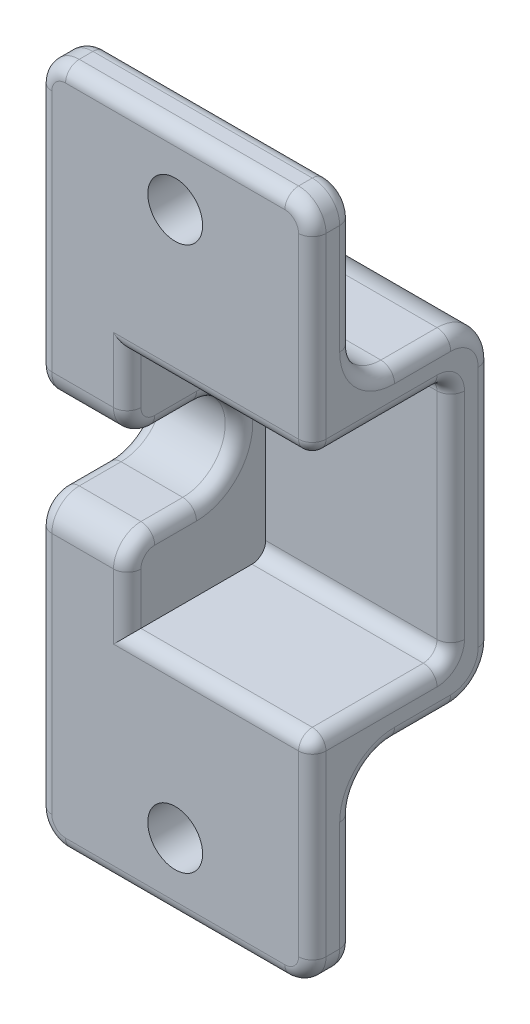
from build123d import *

# Parameters (mm, degrees)
BOSS_EXTRUDE1_DEPTH = 13.5
BOSS_EXTRUDE2_DEPTH = 6.5
FILLET1_R           = 3
FILLET2_R           = 2
SKETCH3_R           = 2
CUT_EXTRUDE1_DEPTH  = 3
FILLET3_R           = 1


with BuildPart() as part:
    # Sketch1 → Boss-Extrude1 (new body)
    with BuildSketch(Plane(origin=(0, 0, 0), x_dir=(0, 0, -1), z_dir=(1, 0, 0))):
        Polygon((0, 0), (3, 0), (3, 13), (13.1, 13), (13.1, 36.7), (3, 36.7), (3, 49.7), (0, 49.7), (0, 33.7), (10.1, 33.7), (10.1, 16), (0, 16), align=None)
    extrude(amount=BOSS_EXTRUDE1_DEPTH)

    # Sketch2 → Boss-Extrude2 (add)
    with BuildSketch(Plane.ZY):
        with BuildLine():
            Line((0, 0), (-3, 0))
            Line((-3, 0), (-3, 13))
            Line((-3, 13), (-13.1, 13))
            Line((-13.1, 13), (-13.1, 36.7))
            Line((-13.1, 36.7), (-3, 36.7))
            Line((-3, 36.7), (-3, 49.7))
            Line((-3, 49.7), (0, 49.7))
            Line((0, 49.7), (0, 27.95))
            Line((0, 27.95), (-5.05, 27.95))
            ThreePointArc((-5.05, 27.95), (-8.15, 24.85), (-5.05, 21.75))
            Line((-5.05, 21.75), (0, 21.75))
            Line((0, 21.75), (0, 0))
        make_face()
    extrude(amount=BOSS_EXTRUDE2_DEPTH)

    # Fillet1
    fillet1_edges = [part.edges().sort_by_distance(p)[0] for p in [
        (3.5, 36.7, -3),
        (3.5, 36.7, -13.1),
        (3.5, 13, -13.1),
        (3.5, 13, -3),
    ]]
    fillet(fillet1_edges, radius=FILLET1_R)

    # Fillet2
    fillet2_edges = [part.edges().sort_by_distance(p)[0] for p in [
        (13.5, 49.7, -1.5),
        (-3.25, 21.75, 0),
        (-3.25, 27.95, 0),
        (-6.5, 49.7, -1.5),
        (-6.5, 0, -1.5),
        (13.5, 0, -1.5),
    ]]
    fillet(fillet2_edges, radius=FILLET2_R)

    # Sketch3 → Cut-Extrude1 (cut)
    with BuildSketch(Plane(origin=(0, 0, -3), x_dir=(-1, 0, 0), z_dir=(0, 0, -1))):
        with Locations((-3.5, 5)):
            Circle(SKETCH3_R)
        with Locations((-3.5, 44.7)):
            Circle(SKETCH3_R)
    extrude(amount=-CUT_EXTRUDE1_DEPTH, mode=Mode.SUBTRACT)

    # Fillet3
    fillet3_edges = [part.edges().sort_by_distance(p)[0] for p in [
        (3.5, 0, -3),
        (-5.914213562, 0.585786438, -3),
        (12.914213562, 0.585786438, -3),
        (3.5, 0, 0),
        (-6.5, 10.875, 0),
        (-5.914213562, 0.585786438, 0),
        (12.914213562, 0.585786438, 0),
        (-6.5, 21.75, -3.525),
        (-6.5, 38.825, 0),
        (-6.5, 43.7, -3),
        (-6.5, 28.535786438, -0.585786438),
        (-6.5, 21.164213562, -0.585786438),
        (3.5, 49.7, -3),
        (12.914213562, 49.114213562, -3),
        (-5.914213562, 49.114213562, -3),
        (3.5, 49.7, 0),
        (0, 31.825, 0),
        (12.914213562, 49.114213562, 0),
        (-5.914213562, 49.114213562, 0),
        (0, 21.75, -3.525),
        (0, 28.535786438, -0.585786438),
        (0, 21.164213562, -0.585786438),
        (6.75, 16, 0),
        (6.75, 16, -10.1),
        (6.75, 33.7, -10.1),
        (6.75, 33.7, 0),
        (0, 17.875, 0),
        (0, 24.85, -8.15),
        (0, 27.95, -3.525),
        (13.5, 33.7, -5.05),
        (-6.5, 24.85, -8.15),
        (-6.5, 27.95, -3.525),
        (13.5, 24.85, -10.1),
        (13.5, 16, -5.05),
        (13.5, 9, 0),
        (-6.5, 24.85, -13.1),
        (13.5, 24.85, -13.1),
        (-6.5, 36.7, -8.05),
        (-6.5, 13, -8.05),
        (-6.5, 6, -3),
        (-6.5, 35.821320344, -12.221320344),
        (-6.5, 13.878679656, -12.221320344),
        (13.5, 13, -8.05),
        (13.5, 36.7, -8.05),
        (13.5, 43.7, -3),
        (13.5, 35.821320344, -12.221320344),
        (13.5, 13.878679656, -12.221320344),
        (-6.5, 12.121320344, -3.878679656),
        (13.5, 12.121320344, -3.878679656),
        (-6.5, 37.578679656, -3.878679656),
        (13.5, 37.578679656, -3.878679656),
        (13.5, 40.7, 0),
        (13.5, 6, -3),
    ]]
    fillet(fillet3_edges, radius=FILLET3_R)


solid = part.part
